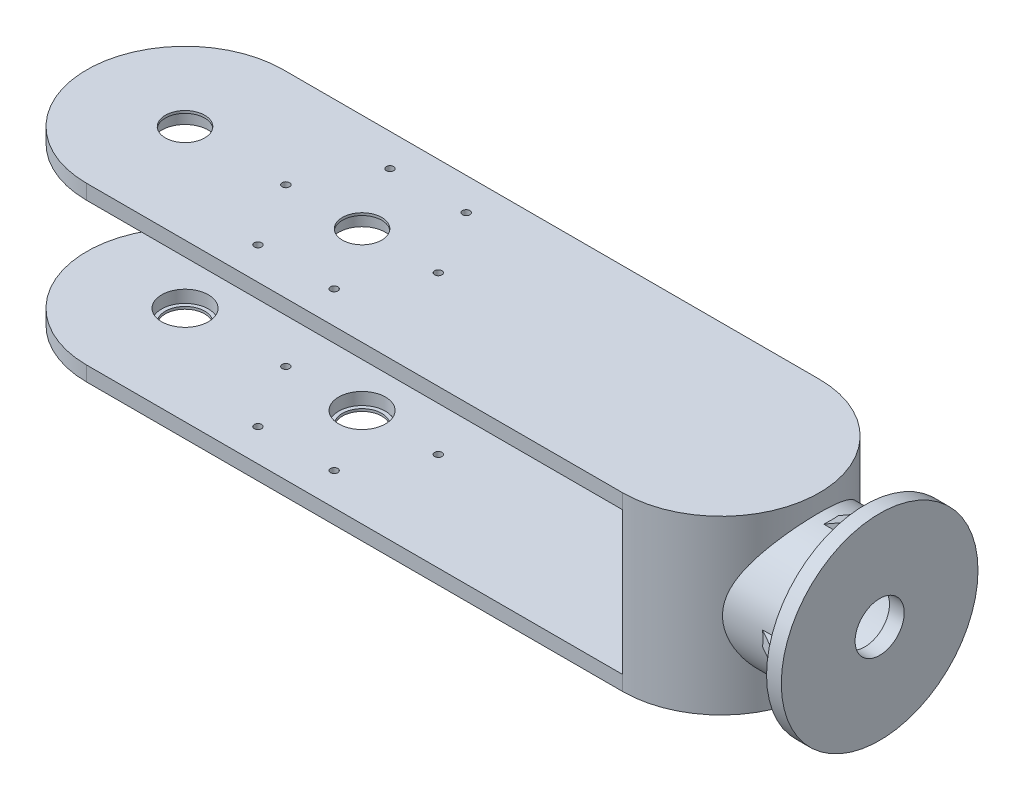
from build123d import *

# Parameters (mm, degrees)
EXTRUDE_1_DEPTH          = 3
EXTRUDE_START            = 58
EXTRUDE_2_DEPTH          = 58
EXTRUDE_3_DEPTH          = 0.0001
EXTRUDE_3_DEPTH_BACK     = 6
SKETCH_3_R               = 40
CUT_EXTRUDE_1_DEPTH      = 295.262309003
CUT_EXTRUDE_1_DEPTH_BACK = 295.262309003
EXTRUDE_4_REACH          = 329.042
EXTRUDE_4_END_RADIUS     = 40
SKETCH_5_R               = 28
SKETCH_5_R_2             = 24
RIB_5_REACH              = 296.262
SKETCH_9_WALL_W          = 606.033549296
SKETCH_9_WALL_H          = 6
PATTERN_CIRCULAR_1_COUNT = 4
SKETCH_10_R              = 10
CUT_EXTRUDE_2_DEPTH      = 333.851693714
SKETCH_11_R              = 8
CUT_EXTRUDE_3_DEPTH      = 296.010593044
SKETCH_12_R              = 8
CUT_EXTRUDE_4_DEPTH      = 296.010593044
SKETCH_13_R              = 9.5
CUT_EXTRUDE_5_DEPTH      = 5
SKETCH_14_R              = 1.5
CUT_EXTRUDE_6_DEPTH      = 296.010593044
PATTERN_CIRCULAR_2_COUNT = 6


with BuildPart() as part:
    # 草图1 → 拉伸1 (new, symmetric)
    with BuildSketch(Plane(origin=(0, 0, 0), x_dir=(1, 0, 0), z_dir=(0, 1, 0))):
        with BuildLine():
            Line((0, 40), (218, 40))
            ThreePointArc((218, 40), (258, 0), (218, -40))
            Line((218, -40), (0, -40))
            ThreePointArc((0, -40), (-40, 0), (0, 40))
        make_face()
    extrude_1 = extrude(amount=EXTRUDE_1_DEPTH, both=True)

    # 草图2 → 拉伸2 (add)
    with BuildSketch(Plane(origin=(0, 3, 0), x_dir=(-1, 0, 0), z_dir=(0, 1, 0)).offset(EXTRUDE_START)):
        with BuildLine():
            Line((-218, -31.8672587), (-218, -40))
            ThreePointArc((-218, -40), (-258, 0), (-218, 40))
            Line((-218, 40), (-218, 31.8672587))
            ThreePointArc((-218, 31.8672587), (-249.8672587, 0), (-218, -31.8672587))
        make_face()
    extrude(amount=-EXTRUDE_2_DEPTH)



with BuildPart() as body_2:
    # 草图3 → 拉伸3 (new, two sides: drawn at the far end of the back side and taken through both)
    with BuildSketch(Plane(origin=(282.5, 0, 0), x_dir=(0, 0, -1), z_dir=(1, 0, 0)).offset(-EXTRUDE_3_DEPTH_BACK)):
        with Locations((0, 32)):
            Circle(SKETCH_3_R)
    extrude(amount=EXTRUDE_3_DEPTH + EXTRUDE_3_DEPTH_BACK)

    # 草图4 → 切除-拉伸1 (cut, two sides: drawn at the far end of the back side and taken through both)
    with BuildSketch(Plane.XY.offset(-CUT_EXTRUDE_1_DEPTH_BACK)):
        Polygon((282.5, 835.056567442), (282.5, 76.149376548), (282.5, -15.878690732), (330.214333685, 15.814216416), (962.375669635, 435.709643541), (1731.108568613, 1744.453402873), (1051.232898978, 2143.800326773), align=None)
    extrude(amount=CUT_EXTRUDE_1_DEPTH + CUT_EXTRUDE_1_DEPTH_BACK, mode=Mode.SUBTRACT)


with BuildPart() as part_1:
    add(part.part)

    add(body_2.part)  # 拉伸4 merges body 2
    # 拉伸4: up to this cylinder (the profile starts outside it)
    extrude_4_end = Plane(origin=(218, 32, 0), z_dir=(0, -1, 0)) * Cylinder(EXTRUDE_4_END_RADIUS, 739.084, mode=Mode.PRIVATE)
    # 草图5 → 拉伸4 (add, up to the surface)
    with BuildSketch(Plane.ZY.offset(-276.5), mode=Mode.PRIVATE) as extrude_4_sk1:
        with Locations((0, 32)):
            Circle(SKETCH_5_R)
        with Locations((0, 32)):
            Circle(SKETCH_5_R_2, mode=Mode.SUBTRACT)
    extrude_4_tool1 = extrude(extrude_4_sk1.sketch, amount=EXTRUDE_4_REACH, mode=Mode.PRIVATE) - extrude_4_end
    add(extrude_4_tool1.solids().sort_by_distance((276.5, 32, -27.20804))[0])

    # 草图9 wall → 筋5 (add, up to next)
    with BuildSketch(Plane(origin=(269.759419485, 0.166228951, 0), x_dir=(-0.869240691269, 0.49438913888, 0), z_dir=(-0.49438913888, -0.869240691269, 0)), mode=Mode.PRIVATE) as rib_5_sk1:
        Rectangle(SKETCH_9_WALL_W, SKETCH_9_WALL_H)
    rib_5_tool1 = extrude(rib_5_sk1.sketch, amount=-RIB_5_REACH, mode=Mode.PRIVATE) - part_1.part
    rib_5 = rib_5_tool1.solids().sort_by_distance((269.759419485, 0.166228951, 0))[0]
    add(rib_5)

    # 阵列(圆周)1: 筋5 ×4 about axis
    pattern_circular_1_axis = Axis((276.5, 32, 0), (-1, 0, 0))
    for i in range(1, PATTERN_CIRCULAR_1_COUNT):
        add(rib_5.rotate(pattern_circular_1_axis, i * 360 / PATTERN_CIRCULAR_1_COUNT))

    # 镜向1: 拉伸1 across plane
    add(extrude_1.mirror(Plane.ZX.offset(32)))

    # 草图10 → 切除-拉伸2 (cut, through all)
    with BuildSketch(Plane(origin=(282.5, 0, 0), x_dir=(0, 0, -1), z_dir=(1, 0, 0))):
        with Locations((0, 32)):
            Circle(SKETCH_10_R)
    extrude(amount=-CUT_EXTRUDE_2_DEPTH, mode=Mode.SUBTRACT)

    # 草图11 → 切除-拉伸3 (cut, through all)
    with BuildSketch(Plane(origin=(0, 67, 0), x_dir=(-1, 0, 0), z_dir=(0, 1, 0))):
        Circle(SKETCH_11_R)
    extrude(amount=-CUT_EXTRUDE_3_DEPTH, mode=Mode.SUBTRACT)

    # 草图12 → 切除-拉伸4 (cut, through all)
    with BuildSketch(Plane(origin=(0, 67, 0), x_dir=(-1, 0, 0), z_dir=(0, 1, 0))):
        with Locations((-72, 0)):
            Circle(SKETCH_12_R)
    extrude(amount=-CUT_EXTRUDE_4_DEPTH, mode=Mode.SUBTRACT)

    # 草图13 → 切除-拉伸5 (cut)
    with BuildSketch(Plane(origin=(0, 3, 0), x_dir=(-1, 0, 0), z_dir=(0, 1, 0))):
        with Locations((-72, 0)):
            Circle(SKETCH_13_R)
        Circle(SKETCH_13_R)
    cut_extrude_5 = extrude(amount=-CUT_EXTRUDE_5_DEPTH, mode=Mode.SUBTRACT)

    # 镜向2: 切除-拉伸5 across plane
    add(cut_extrude_5.mirror(Plane.ZX.offset(32)), mode=Mode.SUBTRACT)

    # 草图14 → 切除-拉伸6 (cut, through all)
    with BuildSketch(Plane(origin=(0, 67, 0), x_dir=(-1, 0, 0), z_dir=(0, 1, 0))):
        with Locations((-41, 0)):
            Circle(SKETCH_14_R)
    cut_extrude_6 = extrude(amount=-CUT_EXTRUDE_6_DEPTH, mode=Mode.SUBTRACT)

    # 阵列(圆周)2: 切除-拉伸6 ×6 about axis
    pattern_circular_2_axis = Axis((72, 66, 0), (0, -1, 0))
    for i in range(1, PATTERN_CIRCULAR_2_COUNT):
        add(cut_extrude_6.rotate(pattern_circular_2_axis, i * 360 / PATTERN_CIRCULAR_2_COUNT), mode=Mode.SUBTRACT)


solid = part_1.part
